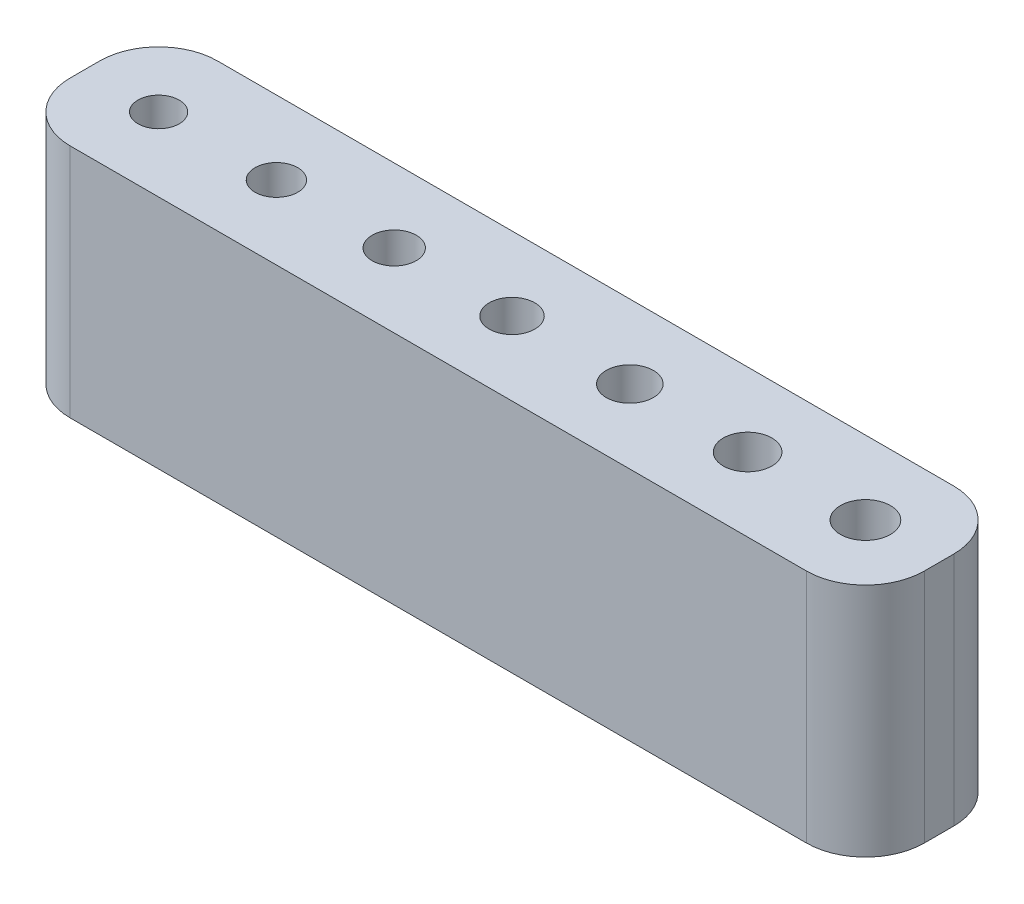
from build123d import *

# Parameters (mm, degrees)
SKETCH1_W           = 29
SKETCH1_H           = 5
SKETCH1_R           = 0.7
SKETCH1_R_2         = 0.725
SKETCH1_R_3         = 0.75
SKETCH1_R_4         = 0.775
SKETCH1_R_5         = 0.85
SKETCH1_R_6         = 0.8
SKETCH1_R_7         = 0.825
BOSS_EXTRUDE1_DEPTH = 8
FILLET1_R           = 2


with BuildPart() as part:
    # Sketch1 → Boss-Extrude1 (new body)
    with BuildSketch(Plane(origin=(0, 0, 0), x_dir=(1, 0, 0), z_dir=(0, 1, 0))):
        with Locations((14.5, 2.5)):
            Rectangle(SKETCH1_W, SKETCH1_H)
        with Locations(Location((2.5, 2.5, 0), (0, 0, 270))):
            Circle(SKETCH1_R, mode=Mode.SUBTRACT)
        with Locations(Location((6.5, 2.5, 0), (0, 0, 270))):
            Circle(SKETCH1_R_2, mode=Mode.SUBTRACT)
        with Locations(Location((10.5, 2.5, 0), (0, 0, 270))):
            Circle(SKETCH1_R_3, mode=Mode.SUBTRACT)
        with Locations(Location((14.5, 2.5, 0), (0, 0, 270))):
            Circle(SKETCH1_R_4, mode=Mode.SUBTRACT)
        with Locations(Location((26.5, 2.5, 0), (0, 0, 270))):
            Circle(SKETCH1_R_5, mode=Mode.SUBTRACT)
        with Locations(Location((18.5, 2.5, 0), (0, 0, 270))):
            Circle(SKETCH1_R_6, mode=Mode.SUBTRACT)
        with Locations(Location((22.5, 2.5, 0), (0, 0, 270))):
            Circle(SKETCH1_R_7, mode=Mode.SUBTRACT)
    extrude(amount=BOSS_EXTRUDE1_DEPTH)

    # Fillet1
    fillet1_edges = [part.edges().sort_by_distance(p)[0] for p in [
        (0, 4, -5),
        (29, 4, -5),
        (29, 4, 0),
        (0, 4, 0),
    ]]
    fillet(fillet1_edges, radius=FILLET1_R)


solid = part.part
